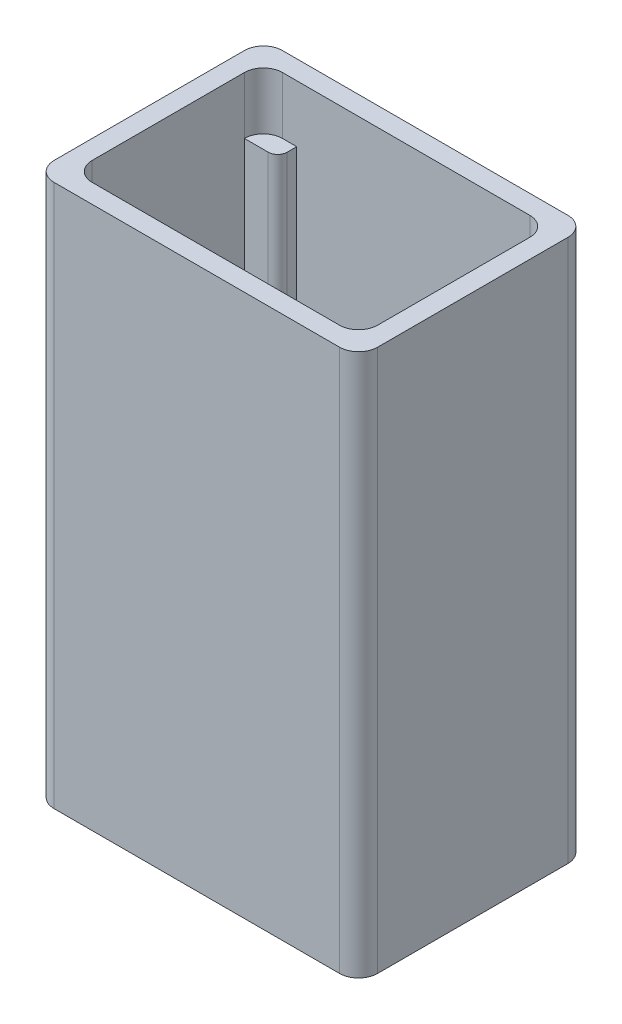
from build123d import *

# Parameters (mm, degrees)
BOSS_EXTRUDE4_DEPTH = 57
BOSS_EXTRUDE5_DEPTH = 51


with BuildPart() as part:
    # Sketch8 → Boss-Extrude4 (new body)
    with BuildSketch(Plane(origin=(0, 58, 0), x_dir=(1, 0, 0), z_dir=(0, 1, 0))):
        with BuildLine():
            Line((-15, -12), (15, -12))
            ThreePointArc((15, -12), (16.414213562, -11.414213562), (17, -10))
            Line((17, -10), (17, 10))
            ThreePointArc((17, 10), (16.414213562, 11.414213562), (15, 12))
            Line((15, 12), (-15, 12))
            ThreePointArc((-15, 12), (-16.414213562, 11.414213562), (-17, 10))
            Line((-17, 10), (-17, -10))
            ThreePointArc((-17, -10), (-16.414213562, -11.414213562), (-15, -12))
        make_face()
        with BuildLine():
            Line((-13, -10), (13, -10))
            ThreePointArc((13, -10), (14.414213562, -9.414213562), (15, -8))
            Line((15, -8), (15, 8))
            ThreePointArc((15, 8), (14.414213562, 9.414213562), (13, 10))
            Line((13, 10), (-13, 10))
            ThreePointArc((-13, 10), (-14.414213562, 9.414213562), (-15, 8))
            Line((-15, 8), (-15, -8))
            ThreePointArc((-15, -8), (-14.414213562, -9.414213562), (-13, -10))
        make_face(mode=Mode.SUBTRACT)
    extrude(amount=BOSS_EXTRUDE4_DEPTH)

    # Sketch11 → Boss-Extrude5 (add)
    with BuildSketch(Plane(origin=(0, 58, 0), x_dir=(1, 0, 0), z_dir=(0, 1, 0))):
        with BuildLine():
            Line((15, 8), (12.5, 8))
            ThreePointArc((12.5, 8), (11.792893219, 8.292893219), (11.5, 9))
            Line((11.5, 9), (11.5, 10))
            Line((11.5, 10), (15, 10))
            Line((15, 10), (15, 8))
        make_face()
        with BuildLine():
            Line((-11.5, 10), (-15, 10))
            Line((-15, 10), (-15, 8))
            Line((-15, 8), (-12.5, 8))
            ThreePointArc((-12.5, 8), (-11.792893219, 8.292893219), (-11.5, 9))
            Line((-11.5, 9), (-11.5, 10))
        make_face()
    extrude(amount=BOSS_EXTRUDE5_DEPTH)


solid = part.part
